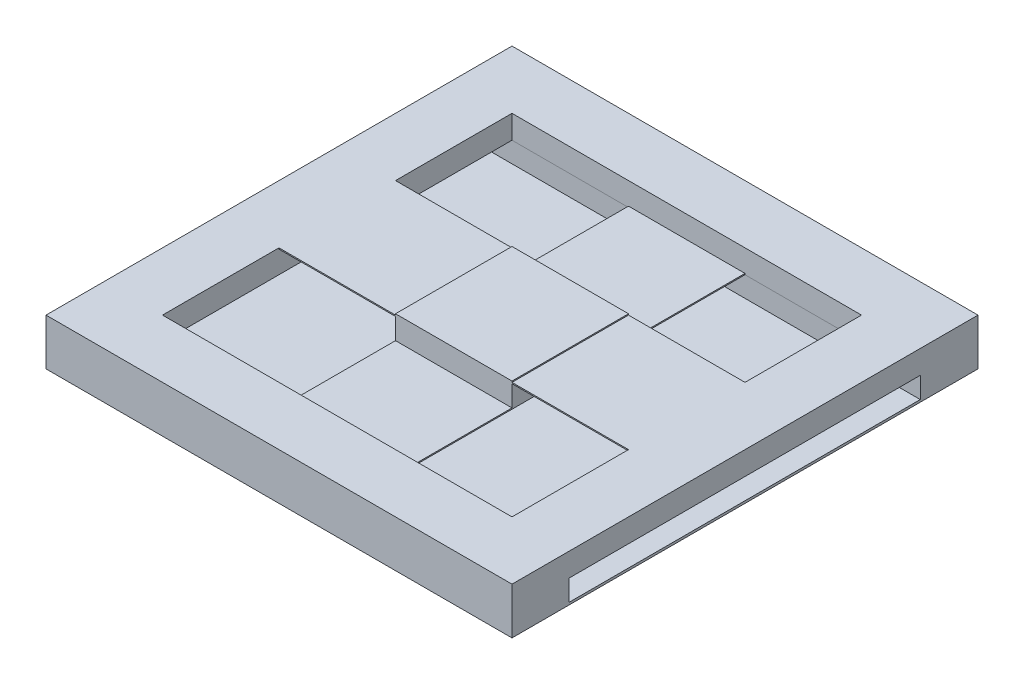
from build123d import *

# Parameters (mm, degrees)
SKETCH1_W           = 1
SKETCH1_H           = 1
BOSS_EXTRUDE1_DEPTH = 0.2
SKETCH2_W           = 4
SKETCH2_H           = 4
SKETCH2_W_2         = 3
SKETCH2_H_2         = 3
BOSS_EXTRUDE2_DEPTH = 0.2
SKETCH3_W           = 1
SKETCH3_H           = 1
BOSS_EXTRUDE3_DEPTH = 0.01
SKETCH4_W           = 1
SKETCH4_H           = 1
BOSS_EXTRUDE4_DEPTH = 0.01
SKETCH6_W           = 1
SKETCH6_H           = 1
BOSS_EXTRUDE5_DEPTH = 0.01
SKETCH8_W           = 4
SKETCH8_H           = 0.490188984
SKETCH8_H_2         = 0.495614814
BOSS_EXTRUDE6_DEPTH = 0.2
SKETCH9_W           = 4
SKETCH9_H           = 0.02
BOSS_EXTRUDE7_DEPTH = 3.014196203


with BuildPart() as part:
    # Sketch1 → Boss-Extrude1 (new body)
    with BuildSketch(Plane(origin=(0, 0, 0), x_dir=(1, 0, 0), z_dir=(0, 1, 0))):
        Rectangle(SKETCH1_W, SKETCH1_H)
    extrude(amount=BOSS_EXTRUDE1_DEPTH)



with BuildPart() as body_2:
    # Sketch2 → Boss-Extrude2 (new body)
    with BuildSketch(Plane(origin=(0, 0.2, 0), x_dir=(1, 0, 0), z_dir=(0, 1, 0))):
        Rectangle(SKETCH2_W, SKETCH2_H)
        Rectangle(SKETCH2_W_2, SKETCH2_H_2, mode=Mode.SUBTRACT)
    extrude(amount=-BOSS_EXTRUDE2_DEPTH)


with BuildPart() as part_1:
    add(part.part)

    add(body_2.part)  # Boss-Extrude3 merges body 2
    # Sketch3 → Boss-Extrude3 (add)
    with BuildSketch(Plane.XZ):
        with Locations((0, -1)):
            Rectangle(SKETCH3_W, SKETCH3_H)
    boss_extrude3 = extrude(amount=-BOSS_EXTRUDE3_DEPTH)

    # Mirror1: Boss-Extrude3 across plane
    add(boss_extrude3.mirror(Plane.XY))

    # Sketch4 → Boss-Extrude4 (add)
    with BuildSketch(Plane(origin=(0, 0.2, 0), x_dir=(1, 0, 0), z_dir=(0, 1, 0))):
        with Locations((1, 0)):
            Rectangle(SKETCH4_W, SKETCH4_H)
    boss_extrude4 = extrude(amount=-BOSS_EXTRUDE4_DEPTH)

    # Mirror2: Boss-Extrude4 across plane
    add(boss_extrude4.mirror(Plane(origin=(0, 0, 0), x_dir=(0, 0, 1), z_dir=(1, 0, 0))))

    # Sketch6 → Boss-Extrude5 (add)
    with BuildSketch(Plane(origin=(0, 0.2, 0), x_dir=(1, 0, 0), z_dir=(0, 1, 0))):
        Rectangle(SKETCH6_W, SKETCH6_H)
    extrude(amount=BOSS_EXTRUDE5_DEPTH)

    # Sketch8 → Boss-Extrude6 (add)
    with BuildSketch(Plane.XZ):
        with Locations((0, 1.754905508)):
            Rectangle(SKETCH8_W, SKETCH8_H)
        with Locations((0, -1.752192593)):
            Rectangle(SKETCH8_W, SKETCH8_H_2)
    extrude(amount=BOSS_EXTRUDE6_DEPTH)

    # Sketch9 → Boss-Extrude7 (add)
    with BuildSketch(Plane(origin=(0, 0, 1.509811016), x_dir=(-1, 0, 0), z_dir=(0, 0, -1))):
        with Locations((0, -0.19)):
            Rectangle(SKETCH9_W, SKETCH9_H)
    extrude(amount=BOSS_EXTRUDE7_DEPTH)


solid = part_1.part
